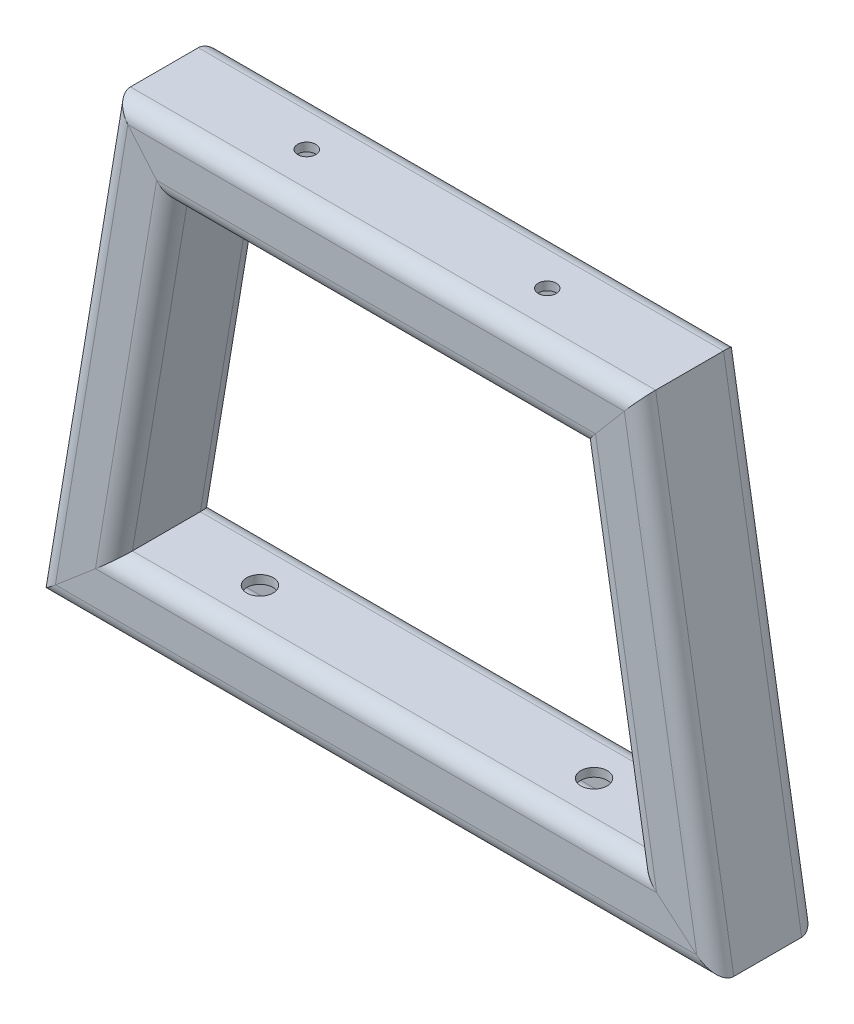
from build123d import *

# Parameters (mm, degrees)
STRUCTURAL_MEMBER1_DEPTH      = 389.790363618
STRUCTURAL_MEMBER1_DEPTH_BACK = 39.790363618
STRUCTURAL_MEMBER1_2_DEPTH    = 398.982350083
STRUCTURAL_MEMBER1_3_DEPTH    = 560.107719899
STRUCTURAL_MEMBER1_4_DEPTH    = 398.982350083


with BuildPart() as part:
    # Sketch141 → Structural Member1 (new, two sides: drawn at the far end of the back side and taken through both)
    with BuildSketch(Plane.YZ.offset(-175).offset(-STRUCTURAL_MEMBER1_DEPTH_BACK)):
        with BuildLine():
            Line((-12.699978, -38.1), (12.699978, -38.1))
            ThreePointArc((12.699978, -38.1), (21.680234121, -34.380256121), (25.399978, -25.4))
            Line((25.399978, -25.4), (25.399978, 25.4))
            ThreePointArc((25.399978, 25.4), (21.680234121, 34.380256121), (12.699978, 38.1))
            Line((12.699978, 38.1), (-12.699978, 38.1))
            ThreePointArc((-12.699978, 38.1), (-21.680234121, 34.380256121), (-25.399978, 25.4))
            Line((-25.399978, 25.4), (-25.399978, -25.4))
            ThreePointArc((-25.399978, -25.4), (-21.680234121, -34.380256121), (-12.699978, -38.1))
        make_face()
        with BuildLine():
            Line((-12.699978, -31.75), (12.699978, -31.75))
            ThreePointArc((12.699978, -31.75), (17.190106061, -29.890128061), (19.049978, -25.4))
            Line((19.049978, -25.4), (19.049978, 25.4))
            ThreePointArc((19.049978, 25.4), (17.190106061, 29.890128061), (12.699978, 31.75))
            Line((12.699978, 31.75), (-12.699978, 31.75))
            ThreePointArc((-12.699978, 31.75), (-17.190106061, 29.890128061), (-19.049978, 25.4))
            Line((-19.049978, 25.4), (-19.049978, -25.4))
            ThreePointArc((-19.049978, -25.4), (-17.190106061, -29.890128061), (-12.699978, -31.75))
        make_face(mode=Mode.SUBTRACT)
    extrude(amount=STRUCTURAL_MEMBER1_DEPTH + STRUCTURAL_MEMBER1_DEPTH_BACK)

    # Structural Member1 mitre 1
    split(bisect_by=Plane(origin=(-175, 0, 0), x_dir=(-0.646374896, 0.763019982, 0), z_dir=(0.763019982, 0.646374896, 0)), keep=Keep.TOP)

    # Structural Member1 mitre 2
    split(bisect_by=Plane(origin=(175, 0, 0), x_dir=(-0.646374896, -0.763019982, 0), z_dir=(-0.763019982, 0.646374896, 0)), keep=Keep.TOP)

    # Sketch143 → 1/2 Clearance Hole1 (revolve, cut)
    with BuildSketch(Plane(origin=(90, 25.399978, 0), x_dir=(0, 0, 1), z_dir=(1, 0, 0))):
        Polygon((0, 0), (0, 54.853549943), (6.74624, 50.8), (6.74624, 0), align=None)
    f_1_2_clearance_hole1 = revolve(axis=Axis((90, 31.749978, 0), (0, -1, 0)), mode=Mode.SUBTRACT)

    # Mirror1: 1/2 Clearance Hole1 across plane
    add(f_1_2_clearance_hole1.mirror(Plane(origin=(0, 0, 0), x_dir=(0, 0, 1), z_dir=(1, 0, 0))), mode=Mode.SUBTRACT)


with BuildPart() as body_2:
    # Sketch141 on segment 2 (carried to segment 2) → Structural Member1 2 (new body)
    with BuildSketch(Plane(origin=(168.458504517, 39.2489729, 0), x_dir=(0.986393924, 0.164398987, 0), z_dir=(0.164398987, -0.986393924, 0))):
        with BuildLine():
            Line((-12.699978, -38.1), (12.699978, -38.1))
            ThreePointArc((12.699978, -38.1), (21.680234121, -34.380256121), (25.399978, -25.4))
            Line((25.399978, -25.4), (25.399978, 25.4))
            ThreePointArc((25.399978, 25.4), (21.680234121, 34.380256121), (12.699978, 38.1))
            Line((12.699978, 38.1), (-12.699978, 38.1))
            ThreePointArc((-12.699978, 38.1), (-21.680234121, 34.380256121), (-25.399978, 25.4))
            Line((-25.399978, 25.4), (-25.399978, -25.4))
            ThreePointArc((-25.399978, -25.4), (-21.680234121, -34.380256121), (-12.699978, -38.1))
        make_face()
        with BuildLine():
            Line((-12.699978, -31.75), (12.699978, -31.75))
            ThreePointArc((12.699978, -31.75), (17.190106061, -29.890128061), (19.049978, -25.4))
            Line((19.049978, -25.4), (19.049978, 25.4))
            ThreePointArc((19.049978, 25.4), (17.190106061, 29.890128061), (12.699978, 31.75))
            Line((12.699978, 31.75), (-12.699978, 31.75))
            ThreePointArc((-12.699978, 31.75), (-17.190106061, 29.890128061), (-19.049978, 25.4))
            Line((-19.049978, 25.4), (-19.049978, -25.4))
            ThreePointArc((-19.049978, -25.4), (-17.190106061, -29.890128061), (-12.699978, -31.75))
        make_face(mode=Mode.SUBTRACT)
    extrude(amount=STRUCTURAL_MEMBER1_2_DEPTH)

    # Structural Member1 2 mitre 1
    split(bisect_by=Plane(origin=(175, 0, 0), x_dir=(0.646374896, 0.763019982, 0), z_dir=(0.763019982, -0.646374896, 0)), keep=Keep.TOP)

    # Structural Member1 2 mitre 2
    split(bisect_by=Plane(origin=(225, -300, 0), x_dir=(-0.763019982, 0.646374896, 0), z_dir=(0.646374896, 0.763019982, 0)), keep=Keep.TOP)


with BuildPart() as body_3:
    # Sketch141 on segment 3 (carried to segment 3) → Structural Member1 3 (new body)
    with BuildSketch(Plane(origin=(280.05385995, -300, 0), x_dir=(0, -1, 0), z_dir=(-1, 0, 0))):
        with BuildLine():
            Line((-12.699978, -38.1), (12.699978, -38.1))
            ThreePointArc((12.699978, -38.1), (21.680234121, -34.380256121), (25.399978, -25.4))
            Line((25.399978, -25.4), (25.399978, 25.4))
            ThreePointArc((25.399978, 25.4), (21.680234121, 34.380256121), (12.699978, 38.1))
            Line((12.699978, 38.1), (-12.699978, 38.1))
            ThreePointArc((-12.699978, 38.1), (-21.680234121, 34.380256121), (-25.399978, 25.4))
            Line((-25.399978, 25.4), (-25.399978, -25.4))
            ThreePointArc((-25.399978, -25.4), (-21.680234121, -34.380256121), (-12.699978, -38.1))
        make_face()
        with BuildLine():
            Line((-12.699978, -31.75), (12.699978, -31.75))
            ThreePointArc((12.699978, -31.75), (17.190106061, -29.890128061), (19.049978, -25.4))
            Line((19.049978, -25.4), (19.049978, 25.4))
            ThreePointArc((19.049978, 25.4), (17.190106061, 29.890128061), (12.699978, 31.75))
            Line((12.699978, 31.75), (-12.699978, 31.75))
            ThreePointArc((-12.699978, 31.75), (-17.190106061, 29.890128061), (-19.049978, 25.4))
            Line((-19.049978, 25.4), (-19.049978, -25.4))
            ThreePointArc((-19.049978, -25.4), (-17.190106061, -29.890128061), (-12.699978, -31.75))
        make_face(mode=Mode.SUBTRACT)
    extrude(amount=STRUCTURAL_MEMBER1_3_DEPTH)

    # Structural Member1 3 mitre 1
    split(bisect_by=Plane(origin=(225, -300, 0), x_dir=(0.763019982, -0.646374896, 0), z_dir=(-0.646374896, -0.763019982, 0)), keep=Keep.TOP)

    # Structural Member1 3 mitre 2
    split(bisect_by=Plane(origin=(-225, -300, 0), x_dir=(0.763019982, 0.646374896, 0), z_dir=(0.646374896, -0.763019982, 0)), keep=Keep.TOP)

    # Sketch144 → 3/4 Clearance Hole2 (revolve, cut)
    with BuildSketch(Plane(origin=(125, -274.600022, 0), x_dir=(0, 0, 1), z_dir=(1, 0, 0))):
        Polygon((0, 0), (0, 56.761282408), (9.92124, 50.8), (9.92124, 0), align=None)
    f_3_4_clearance_hole2 = revolve(axis=Axis((125, -268.250022, 0), (0, -1, 0)), mode=Mode.SUBTRACT)

    # Mirror2: 3/4 Clearance Hole2 across plane
    add(f_3_4_clearance_hole2.mirror(Plane(origin=(0, 0, 0), x_dir=(0, 0, 1), z_dir=(1, 0, 0))), mode=Mode.SUBTRACT)


with BuildPart() as body_4:
    # Sketch141 on segment 4 (carried to segment 4) → Structural Member1 4 (new body)
    with BuildSketch(Plane(origin=(-234.050798823, -354.304792938, 0), x_dir=(-0.986393924, 0.164398987, 0), z_dir=(0.164398987, 0.986393924, 0))):
        with BuildLine():
            Line((-12.699978, -38.1), (12.699978, -38.1))
            ThreePointArc((12.699978, -38.1), (21.680234121, -34.380256121), (25.399978, -25.4))
            Line((25.399978, -25.4), (25.399978, 25.4))
            ThreePointArc((25.399978, 25.4), (21.680234121, 34.380256121), (12.699978, 38.1))
            Line((12.699978, 38.1), (-12.699978, 38.1))
            ThreePointArc((-12.699978, 38.1), (-21.680234121, 34.380256121), (-25.399978, 25.4))
            Line((-25.399978, 25.4), (-25.399978, -25.4))
            ThreePointArc((-25.399978, -25.4), (-21.680234121, -34.380256121), (-12.699978, -38.1))
        make_face()
        with BuildLine():
            Line((-12.699978, -31.75), (12.699978, -31.75))
            ThreePointArc((12.699978, -31.75), (17.190106061, -29.890128061), (19.049978, -25.4))
            Line((19.049978, -25.4), (19.049978, 25.4))
            ThreePointArc((19.049978, 25.4), (17.190106061, 29.890128061), (12.699978, 31.75))
            Line((12.699978, 31.75), (-12.699978, 31.75))
            ThreePointArc((-12.699978, 31.75), (-17.190106061, 29.890128061), (-19.049978, 25.4))
            Line((-19.049978, 25.4), (-19.049978, -25.4))
            ThreePointArc((-19.049978, -25.4), (-17.190106061, -29.890128061), (-12.699978, -31.75))
        make_face(mode=Mode.SUBTRACT)
    extrude(amount=STRUCTURAL_MEMBER1_4_DEPTH)

    # Structural Member1 4 mitre 1
    split(bisect_by=Plane(origin=(-225, -300, 0), x_dir=(-0.763019982, -0.646374896, 0), z_dir=(-0.646374896, 0.763019982, 0)), keep=Keep.TOP)

    # Structural Member1 4 mitre 2
    split(bisect_by=Plane(origin=(-175, 0, 0), x_dir=(0.646374896, -0.763019982, 0), z_dir=(-0.763019982, -0.646374896, 0)), keep=Keep.TOP)


solid = Compound([part.part, body_2.part, body_3.part, body_4.part])
